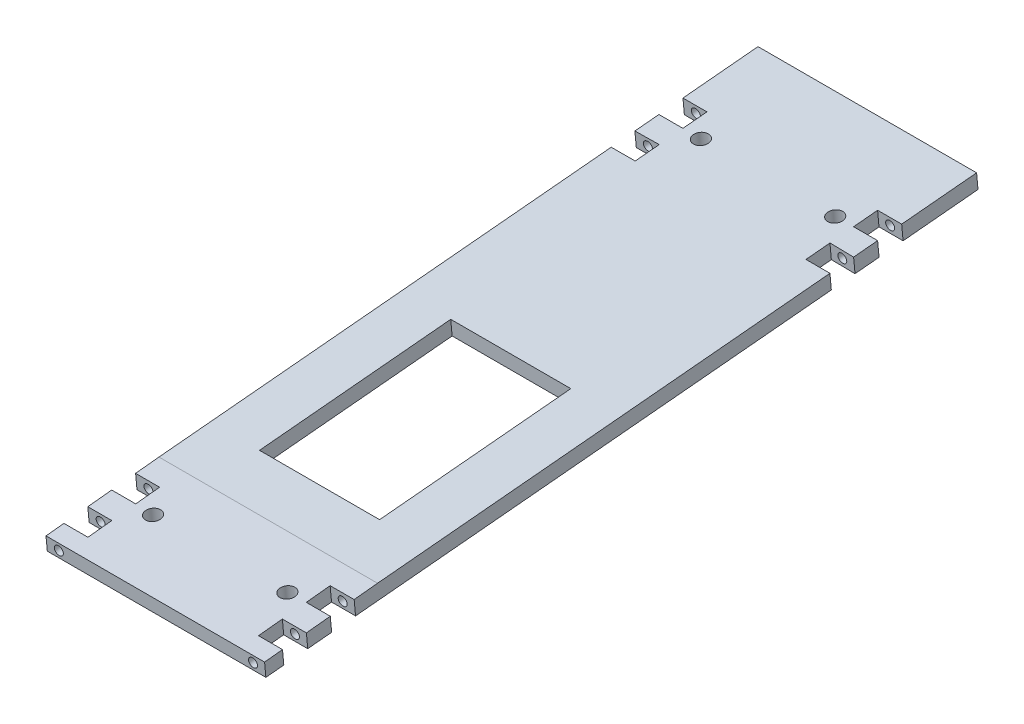
from build123d import *

# Parameters (mm, degrees)
FRAME_DEPTH              = 46.228
SKETCH7_W                = 50.8
SKETCH7_H                = 81.247188803
BATTERY_SLOT_DEPTH       = 32.131
EXTRUDE25_DEPTH          = 12.7
LOW_A_ARM_MOUNTING_DEPTH = 8.128
REAR_HINGE_HOLES_REACH   = 309.358
SKETCH25_R               = 1.905
SKETCH33_R               = 3.175
EXTRUDE23_DEPTH          = 9.652
SKETCH32_R               = 3.175
EXTRUDE24_DEPTH          = 9.652
SKETCH34_R               = 1.905
EXTRUDE26_DEPTH          = 40.894


with BuildPart() as part:
    # Sketch2 → Frame (new, symmetric)
    with BuildSketch(Plane(origin=(0, 0, 0), x_dir=(0, 0, -1), z_dir=(1, 0, 0))):
        Polygon((-113.716301345, -32.469135694), (-63.34929575, -27.768288573), (187.512811896, -4.354857448), (186.914499493, 2.05573268), (-66.485612868, -21.594575186), (-114.265856874, -26.580948798), align=None)
    extrude(amount=FRAME_DEPTH, both=True)

    # Sketch7 → Battery Slot (cut)
    with BuildSketch(Plane(origin=(0, -15.256451714, -1.42391326), x_dir=(1, 0, 0), z_dir=(0, 0.9956728299897474, 0.09292801310803929))):
        with Locations((0, -5.788843516)):
            Rectangle(SKETCH7_W, SKETCH7_H)
    extrude(amount=-BATTERY_SLOT_DEPTH, mode=Mode.SUBTRACT)

    # Sketch20 → Extrude25 (cut)
    with BuildSketch(Plane(origin=(0, -21.667041842, -2.022225663), x_dir=(1, 0, 0), z_dir=(0, -0.9956728299897474, -0.09292801310803922))):
        Polygon((54.692263435, 108.621523843), (36.068, 108.621523843), (36.068, 98.461523843), (48.857667711, 98.461523843), (48.857667711, 88.301523843), (36.068, 88.301523843), (36.068, 78.141523843), (53.624725675, 78.141523843), align=None)
        Polygon((-53.624725675, 78.141523843), (-54.692263435, 108.621523843), (-36.068, 108.621523843), (-36.068, 98.461523843), (-48.857667711, 98.461523843), (-48.857667711, 88.301523843), (-36.068, 88.301523843), (-36.068, 78.141523843), align=None)
    extrude(amount=-EXTRUDE25_DEPTH, mode=Mode.SUBTRACT)

    # Sketch24 → Low A-Arm Mounting (cut)
    with BuildSketch(Plane(origin=(0, -15.256451714, -1.42391326), x_dir=(1, 0, 0), z_dir=(0, 0.9956728299897474, 0.09292801310803929))):
        Polygon((56.409110401, 123.988548499), (56.409110401, 154.468520321), (36.047664653, 154.468520321), (36.061546605, 144.259475636), (46.249110401, 144.259475636), (46.249110401, 134.050421513), (36.07522845, 134.197593184), (36.089110401, 123.988548499), align=None)
        Polygon((-36.089110402, 123.939475636), (-56.409091616, 123.911845137), (-56.450537326, 154.39178878), (-36.089110402, 154.419475636), (-36.089110402, 144.210421513), (-46.27666478, 144.196568783), (-46.262782828, 133.987524098), (-36.089110402, 134.148529759), align=None)
    extrude(amount=-LOW_A_ARM_MOUNTING_DEPTH, mode=Mode.SUBTRACT)

    # Rear Hinge Holes: up to this face of the body (flat: up to its plane)
    rear_hinge_holes_end = Plane(part.part.faces().sort_by_distance((41.158555201, -6.939737318, -125.175098432))[0])
    # Sketch25 → Rear Hinge Holes (cut, up to the picked face)
    with BuildSketch(Plane(origin=(0, 17.312184394, -185.490586234), x_dir=(-1, 0, 0), z_dir=(0, 0.09292801310803887, -0.9956728299897473)), mode=Mode.PRIVATE) as rear_hinge_holes_sk1:
        with Locations(Location((-41.073322363, -18.541981083, 0), (0, 0, 90))):
            Circle(SKETCH25_R)
    rear_hinge_holes_tool1 = split(extrude(rear_hinge_holes_sk1.sketch, amount=-REAR_HINGE_HOLES_REACH, mode=Mode.PRIVATE), bisect_by=rear_hinge_holes_end, keep=Keep.BOTH, mode=Mode.PRIVATE)
    # Sketch25 → Rear Hinge Holes (cut, up to the picked face)
    with BuildSketch(Plane(origin=(0, 17.312184394, -185.490586234), x_dir=(-1, 0, 0), z_dir=(0, 0.09292801310803887, -0.9956728299897473)), mode=Mode.PRIVATE) as rear_hinge_holes_sk2:
        with Locations(Location((41.073322363, -18.541981083, 0), (0, 0, 180))):
            Circle(SKETCH25_R)
    rear_hinge_holes_tool2 = split(extrude(rear_hinge_holes_sk2.sketch, amount=-REAR_HINGE_HOLES_REACH, mode=Mode.PRIVATE), bisect_by=rear_hinge_holes_end, keep=Keep.BOTH, mode=Mode.PRIVATE)
    add(rear_hinge_holes_tool1.solids().sort_by(Axis((41.073322, -1.149562, -187.213656), (0, -0.09292801310803887, 0.9956728299897473)))[0], mode=Mode.SUBTRACT)
    add(rear_hinge_holes_tool2.solids().sort_by(Axis((-41.073322, -1.149562, -187.213656), (0, -0.09292801310803887, 0.9956728299897473)))[0], mode=Mode.SUBTRACT)

    # Sketch33 → Extrude23 (cut)
    with BuildSketch(Plane(origin=(0, -21.667041842, -2.022225663), x_dir=(1, 0, 0), z_dir=(0, -0.9956728299897473, -0.09292801310803925))):
        with Locations(Location((28.407237147, -144.13272383, 0), (0, 0, 270))):
            Circle(SKETCH33_R)
        with Locations(Location((-28.407237147, -144.13272383, 0), (0, 0, 270))):
            Circle(SKETCH33_R)
    extrude(amount=-EXTRUDE23_DEPTH, mode=Mode.SUBTRACT)

    # Sketch32 → Extrude24 (cut)
    with BuildSketch(Plane(origin=(0, -21.667041842, -2.022225663), x_dir=(1, 0, 0), z_dir=(0, -0.9956728299897473, -0.0929280131080392))):
        with Locations(Location((28.407237147, 88.619023843, 0), (0, 0, 270))):
            Circle(SKETCH32_R)
        with Locations(Location((-28.407237147, 88.619023843, 0), (0, 0, 90))):
            Circle(SKETCH32_R)
    extrude(amount=-EXTRUDE24_DEPTH, mode=Mode.SUBTRACT)

    # Sketch34 → Extrude26 (cut)
    with BuildSketch(Plane(origin=(0, -10.802093851, 115.738527007), x_dir=(1, 0, 0), z_dir=(0, -0.09292801310803855, 0.9956728299897473))):
        with Locations(Location((-41.073774155, -18.804317875, 0), (0, 0, 270))):
            Circle(SKETCH34_R)
        with Locations(Location((41.073774155, -18.804317875, 0), (0, 0, 270))):
            Circle(SKETCH34_R)
    extrude(amount=-EXTRUDE26_DEPTH, mode=Mode.SUBTRACT)


solid = part.part
